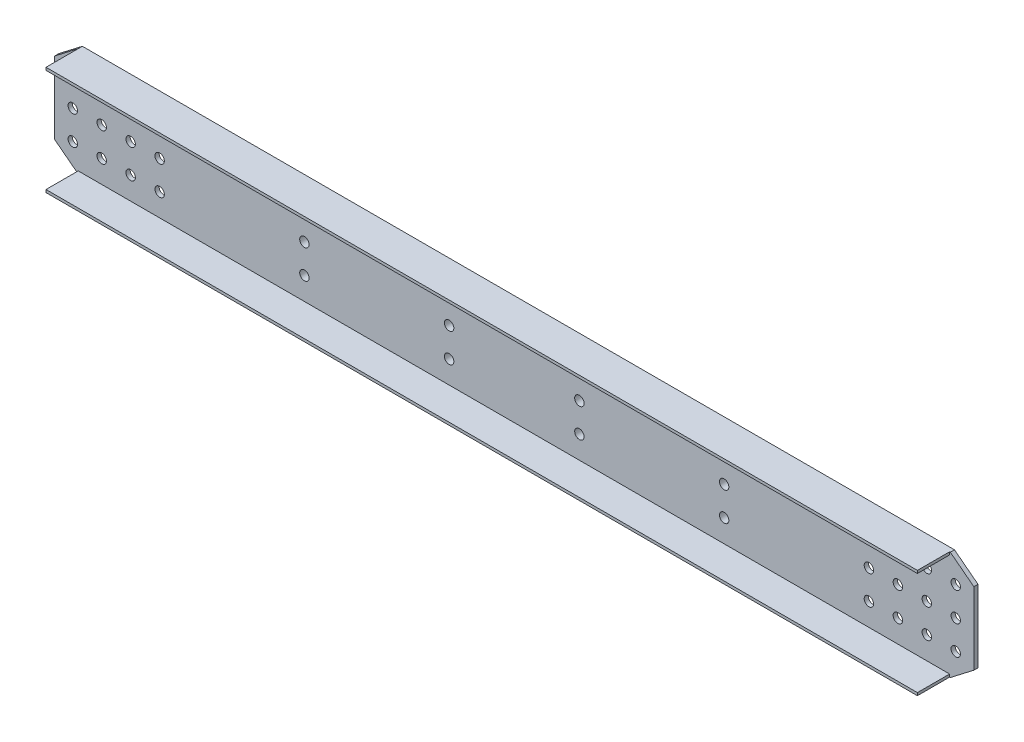
from build123d import *

# Parameters (mm, degrees)
SKETCH_1_R          = 13
EXTRUDE_725_DEPTH   = 11.5
SKETCH_2_W          = 2408.049034164
SKETCH_2_H          = 7.5
EXTRUDE_1_DEPTH     = 89
SKETCH_3_W          = 80
SKETCH_3_H          = 240
EXTRUDE_2_DEPTH     = 16
SKETCH_4_R          = 13
CUT_EXTRUDE_1_DEPTH = 1308.983562588


with BuildPart() as part:
    # 草图1 → Extrude 725 (new body)
    with BuildSketch(Plane.XY):
        Polygon((-1205, 0), (1205, 0), (1270, 50), (1270, 250), (1205, 300), (-1205, 300), (-1270, 250), (-1270, 50), align=None)
        with Locations((-1220, 230)):
            Circle(SKETCH_1_R, mode=Mode.SUBTRACT)
        with Locations((-1220, 150)):
            Circle(SKETCH_1_R, mode=Mode.SUBTRACT)
        with Locations((-1140, 230)):
            Circle(SKETCH_1_R, mode=Mode.SUBTRACT)
        with Locations((-1140, 150)):
            Circle(SKETCH_1_R, mode=Mode.SUBTRACT)
        with Locations((-1060, 230)):
            Circle(SKETCH_1_R, mode=Mode.SUBTRACT)
        with Locations((-1060, 150)):
            Circle(SKETCH_1_R, mode=Mode.SUBTRACT)
        with Locations((-980, 150)):
            Circle(SKETCH_1_R, mode=Mode.SUBTRACT)
        with Locations(Location((-1060, 70, 0), (0, 0, 180))):
            Circle(SKETCH_1_R, mode=Mode.SUBTRACT)
        with Locations(Location((-1140, 70, 0), (0, 0, 180))):
            Circle(SKETCH_1_R, mode=Mode.SUBTRACT)
        with Locations(Location((-1220, 70, 0), (0, 0, 180))):
            Circle(SKETCH_1_R, mode=Mode.SUBTRACT)
        with Locations((1220, 70)):
            Circle(SKETCH_1_R, mode=Mode.SUBTRACT)
        with Locations((1140, 70)):
            Circle(SKETCH_1_R, mode=Mode.SUBTRACT)
        with Locations((1060, 70)):
            Circle(SKETCH_1_R, mode=Mode.SUBTRACT)
        with Locations(Location((980, 150, 0), (0, 0, 180))):
            Circle(SKETCH_1_R, mode=Mode.SUBTRACT)
        with Locations(Location((1060, 150, 0), (0, 0, 180))):
            Circle(SKETCH_1_R, mode=Mode.SUBTRACT)
        with Locations(Location((1060, 230, 0), (0, 0, 180))):
            Circle(SKETCH_1_R, mode=Mode.SUBTRACT)
        with Locations(Location((1140, 150, 0), (0, 0, 180))):
            Circle(SKETCH_1_R, mode=Mode.SUBTRACT)
        with Locations(Location((1140, 230, 0), (0, 0, 180))):
            Circle(SKETCH_1_R, mode=Mode.SUBTRACT)
        with Locations(Location((1220, 150, 0), (0, 0, 180))):
            Circle(SKETCH_1_R, mode=Mode.SUBTRACT)
        with Locations(Location((1220, 230, 0), (0, 0, 180))):
            Circle(SKETCH_1_R, mode=Mode.SUBTRACT)
        with Locations((-980, 70)):
            Circle(SKETCH_1_R, mode=Mode.SUBTRACT)
        with Locations((-980, 230)):
            Circle(SKETCH_1_R, mode=Mode.SUBTRACT)
        with Locations((980, 70)):
            Circle(SKETCH_1_R, mode=Mode.SUBTRACT)
        with Locations((980, 230)):
            Circle(SKETCH_1_R, mode=Mode.SUBTRACT)
    extrude(amount=-EXTRUDE_725_DEPTH)

    # 草图2 → 凸台-拉伸1 (add)
    with BuildSketch(Plane.XY):
        with Locations((-0.975482918, 296.25)):
            Rectangle(SKETCH_2_W, SKETCH_2_H)
        with Locations((-0.975482918, 3.75)):
            Rectangle(SKETCH_2_W, SKETCH_2_H)
    extrude(amount=EXTRUDE_1_DEPTH)

    # 草图3 → 凸台-拉伸2 (add)
    with BuildSketch(Plane(origin=(0, 0, -11.5), x_dir=(-1, 0, 0), z_dir=(0, 0, -1))):
        with Locations((-580, 150)):
            Rectangle(SKETCH_3_W, SKETCH_3_H)
        with Locations((-180, 150)):
            Rectangle(SKETCH_3_W, SKETCH_3_H)
        with Locations((180, 150)):
            Rectangle(SKETCH_3_W, SKETCH_3_H)
        with Locations((580, 150)):
            Rectangle(SKETCH_3_W, SKETCH_3_H)
    extrude(amount=EXTRUDE_2_DEPTH)

    # 草图4 → 切除-拉伸1 (cut, through all)
    with BuildSketch(Plane.XY):
        with Locations((-580, 230)):
            Circle(SKETCH_4_R)
        with Locations((-580, 150)):
            Circle(SKETCH_4_R)
        with Locations((-180, 230)):
            Circle(SKETCH_4_R)
        with Locations((-180, 150)):
            Circle(SKETCH_4_R)
        with Locations(Location((-180, 70, 0), (0, 0, 180))):
            Circle(SKETCH_4_R)
        with Locations(Location((-580, 70, 0), (0, 0, 180))):
            Circle(SKETCH_4_R)
        with Locations((580, 70)):
            Circle(SKETCH_4_R)
        with Locations((180, 70)):
            Circle(SKETCH_4_R)
        with Locations(Location((180, 150, 0), (0, 0, 180))):
            Circle(SKETCH_4_R)
        with Locations(Location((180, 230, 0), (0, 0, 180))):
            Circle(SKETCH_4_R)
        with Locations(Location((580, 150, 0), (0, 0, 180))):
            Circle(SKETCH_4_R)
        with Locations(Location((580, 230, 0), (0, 0, 180))):
            Circle(SKETCH_4_R)
    extrude(amount=-CUT_EXTRUDE_1_DEPTH, mode=Mode.SUBTRACT)


solid = part.part
